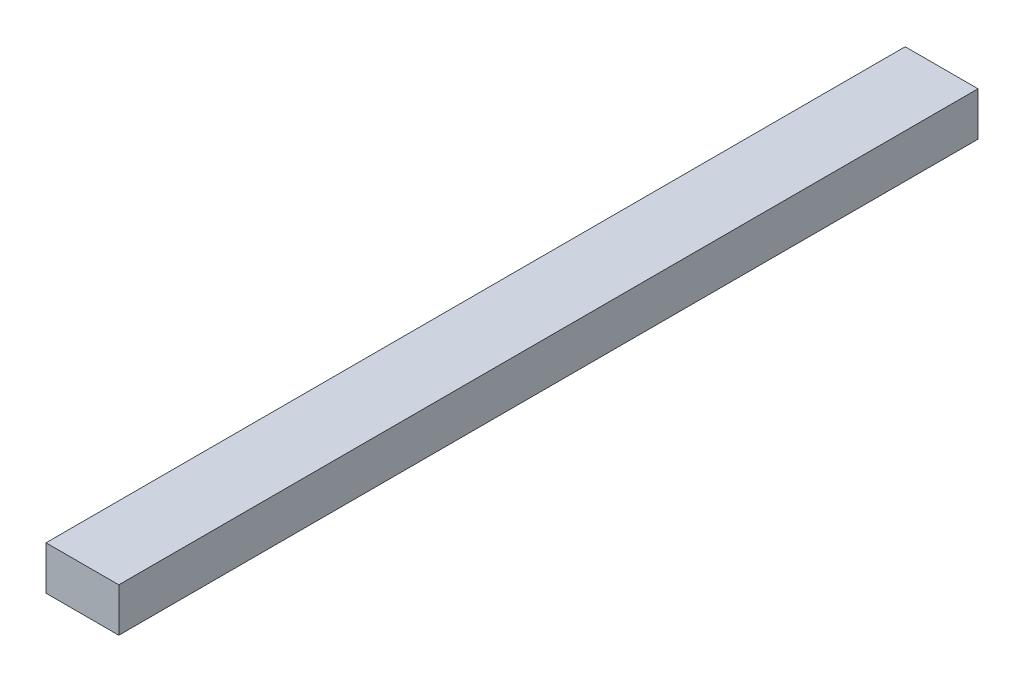
from build123d import *

# Parameters (mm, degrees)
SKIZZE1_W                       = 100
SKIZZE1_H                       = 60
AUFSATZ_LINEAR_AUSTRAGEN1_DEPTH = 590


with BuildPart() as part:
    # Skizze1 → Aufsatz-Linear austragen1 (new, symmetric)
    with BuildSketch(Plane.XY):
        Rectangle(SKIZZE1_W, SKIZZE1_H)
    extrude(amount=AUFSATZ_LINEAR_AUSTRAGEN1_DEPTH, both=True)


solid = part.part
